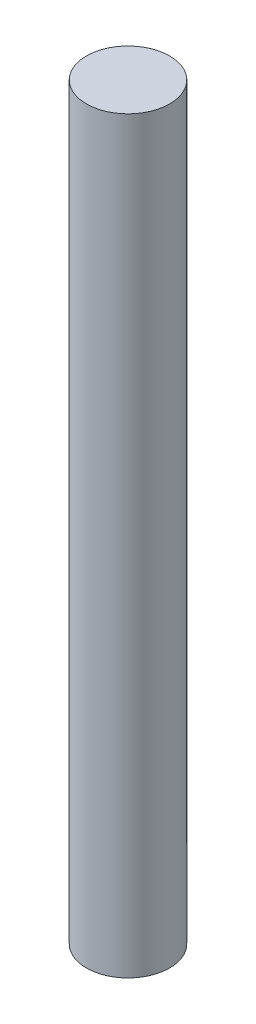
from build123d import *

# Parameters (mm, degrees)
SKETCH1_R           = 2.5
BOSS_EXTRUDE1_DEPTH = 45


with BuildPart() as part:
    # Sketch1 → Boss-Extrude1 (new body)
    with BuildSketch(Plane(origin=(0, 0, 0), x_dir=(1, 0, 0), z_dir=(0, 1, 0))):
        with Locations(Location((0, 0, 0), (0, 0, 90))):
            Circle(SKETCH1_R)
    extrude(amount=BOSS_EXTRUDE1_DEPTH)


solid = part.part
